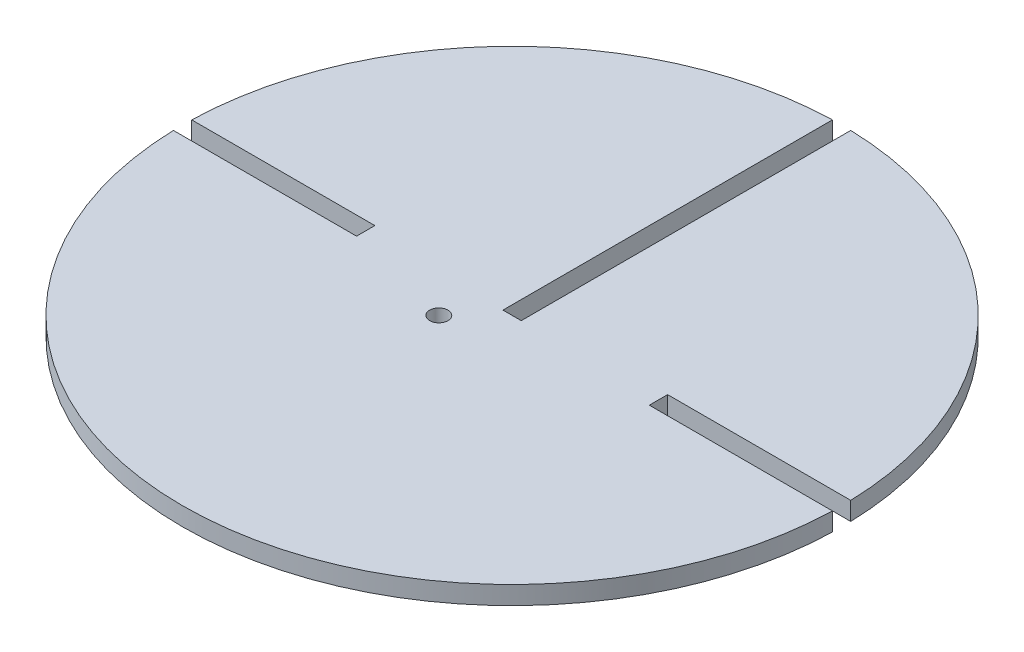
from build123d import *

# Parameters (mm, degrees)
SKETCH1_R           = 114.3
BOSS_EXTRUDE1_DEPTH = 6.35
CUT_EXTRUDE2_DEPTH  = 162.769287876
CUT_EXTRUDE3_DEPTH  = 162.769287876
CUT_EXTRUDE5_DEPTH  = 162.738127462
SKETCH6_R           = 3.175
CUT_EXTRUDE6_DEPTH  = 162.738127462


with BuildPart() as part:
    # Sketch1 → Boss-Extrude1 (new body)
    with BuildSketch(Plane(origin=(0, 0, 0), x_dir=(1, 0, 0), z_dir=(0, 1, 0))):
        Circle(SKETCH1_R)
    extrude(amount=BOSS_EXTRUDE1_DEPTH)

    # Sketch3 → Cut-Extrude2 (cut, through all)
    with BuildSketch(Plane(origin=(0, 6.35, 0), x_dir=(1, 0, 0), z_dir=(0, 1, 0))):
        Polygon((114.255894268, 3.175), (120.605894268, 3.175), (120.605894268, -3.175), (114.255894268, -3.175), (50.755894268, -3.175), (50.755894268, 3.175), align=None)
    extrude(amount=-CUT_EXTRUDE2_DEPTH, mode=Mode.SUBTRACT)

    # Sketch4 → Cut-Extrude3 (cut, through all)
    with BuildSketch(Plane(origin=(0, 6.35, 0), x_dir=(1, 0, 0), z_dir=(0, 1, 0))):
        Polygon((-50.755894268, -3.175), (-114.255894268, -3.175), (-120.605894268, -3.175), (-120.605894268, 3.175), (-114.255894268, 3.175), (-50.755894268, 3.175), align=None)
    extrude(amount=-CUT_EXTRUDE3_DEPTH, mode=Mode.SUBTRACT)

    # Sketch5 → Cut-Extrude5 (cut, through all)
    with BuildSketch(Plane(origin=(0, 6.35, 0), x_dir=(1, 0, 0), z_dir=(0, 1, 0))):
        Polygon((-3.175, 0), (3.175, 0), (3.175, 114.255894268), (3.175, 116.129613815), (-3.175, 116.129613815), (-3.175, 114.255894268), align=None)
    extrude(amount=-CUT_EXTRUDE5_DEPTH, mode=Mode.SUBTRACT)

    # Sketch6 → Cut-Extrude6 (cut, through all)
    with BuildSketch(Plane(origin=(0, 6.35, 0), x_dir=(1, 0, 0), z_dir=(0, 1, 0))):
        with Locations((-12.7, -12.7)):
            Circle(SKETCH6_R)
    extrude(amount=-CUT_EXTRUDE6_DEPTH, mode=Mode.SUBTRACT)


solid = part.part
